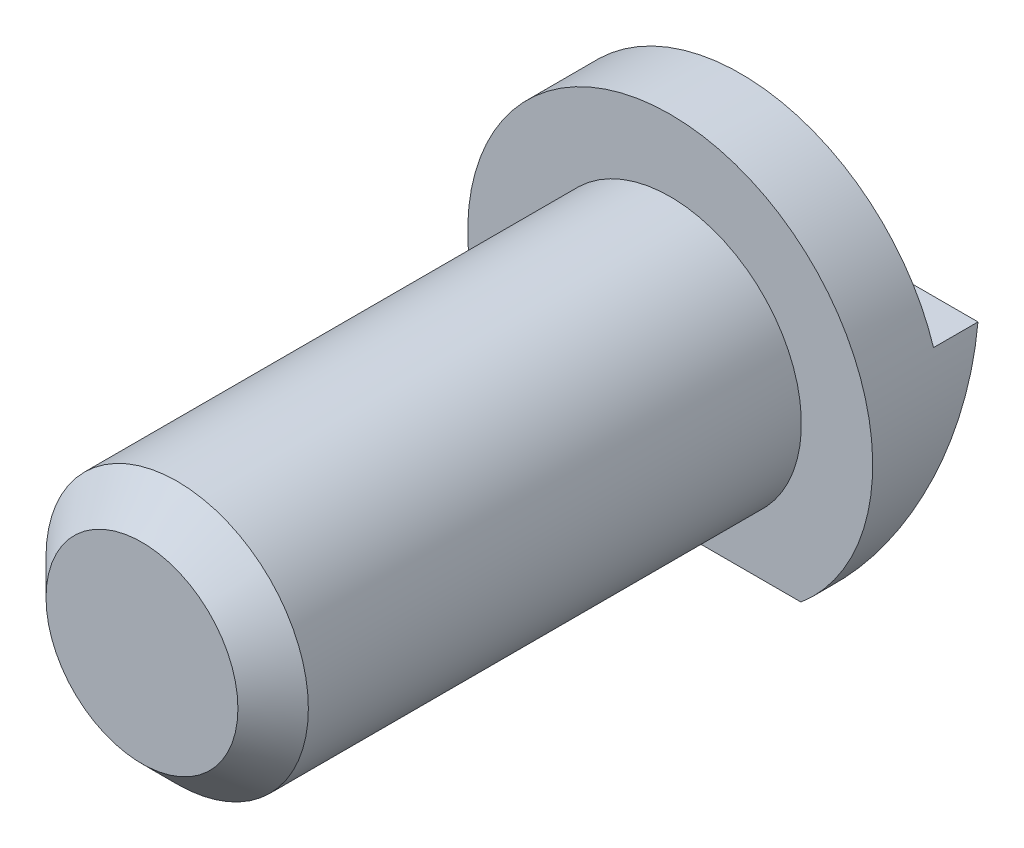
from build123d import *

# Parameters (mm, degrees)
SKETCH_1_R          = 3.725
EXTRUDE_1_DEPTH     = 15
EXTRUDE_START       = 5
SKETCH_2_R          = 3.725
EXTRUDE_2_DEPTH     = 5
CHAMFER_2_SIZE      = 1
CHAMFER_3_SIZE      = 4.5
CHAMFER_3_SIZE2     = 10
CUT_EXTRUDE_1_DEPTH = 3


with BuildPart() as part:
    # 스케치1 → 보스-돌출1 (new body)
    with BuildSketch(Plane.XY):
        Circle(SKETCH_1_R)
    extrude(amount=EXTRUDE_1_DEPTH)

    # 스케치2 → 보스-돌출2 (add)
    # profile 1 of 2: a face of its own
    with BuildSketch(Plane(origin=(0, 0, 0), x_dir=(-1, 0, 0), z_dir=(0, 0, -1)).offset(EXTRUDE_START)):
        with BuildLine():
            ThreePointArc((5.75, 0), (-2.419672395, 5.216098686), (-3.713542783, -4.39))
            Line((-3.713542783, -4.39), (3.713542783, -4.39))
            ThreePointArc((3.713542783, -4.39), (5.216098686, -2.419672395), (5.75, 0))
        make_face()
        Circle(SKETCH_2_R, mode=Mode.SUBTRACT)
    # profile 2 of 2: a face of its own
    with BuildSketch(Plane(origin=(0, 0, 0), x_dir=(-1, 0, 0), z_dir=(0, 0, -1)).offset(EXTRUDE_START)):
        Circle(SKETCH_2_R)
    extrude(amount=-EXTRUDE_2_DEPTH)

    # 모따기2
    chamfer_2_edges = [part.edges().sort_by_distance(p)[0] for p in [
        (-3.725, 0, 15),
    ]]
    chamfer(chamfer_2_edges, length=CHAMFER_2_SIZE)

    # 모따기3
    chamfer_3_edges = [part.edges().sort_by_distance(p)[0] for p in [
        (0, -4.39, -5),
    ]]
    chamfer_3_side = [part.faces().sort_by_distance(p)[0] for p in [
        (0, -4.39, -2.5),
    ]]
    chamfer(chamfer_3_edges, length=CHAMFER_3_SIZE, length2=CHAMFER_3_SIZE2, reference=chamfer_3_side[0])

    # 스케치3 → 컷-돌출1 (cut)
    with BuildSketch(Plane(origin=(0, 0, -5), x_dir=(-1, 0, 0), z_dir=(0, 0, -1))):
        with BuildLine():
            ThreePointArc((-1.261110622, 5.61), (-3.882807448, 4.241026565), (-5.477225575, 1.75))
            Line((-5.477225575, 1.75), (5.477225575, 1.75))
            ThreePointArc((5.477225575, 1.75), (3.882807448, 4.241026565), (1.261110622, 5.61))
            Line((1.261110622, 5.61), (-1.261110622, 5.61))
        make_face()
        with BuildLine():
            Line((-1.261110622, 5.61), (1.261110622, 5.61))
            ThreePointArc((1.261110622, 5.61), (0, 5.75), (-1.261110622, 5.61))
        make_face()
    extrude(amount=-CUT_EXTRUDE_1_DEPTH, mode=Mode.SUBTRACT)


solid = part.part
